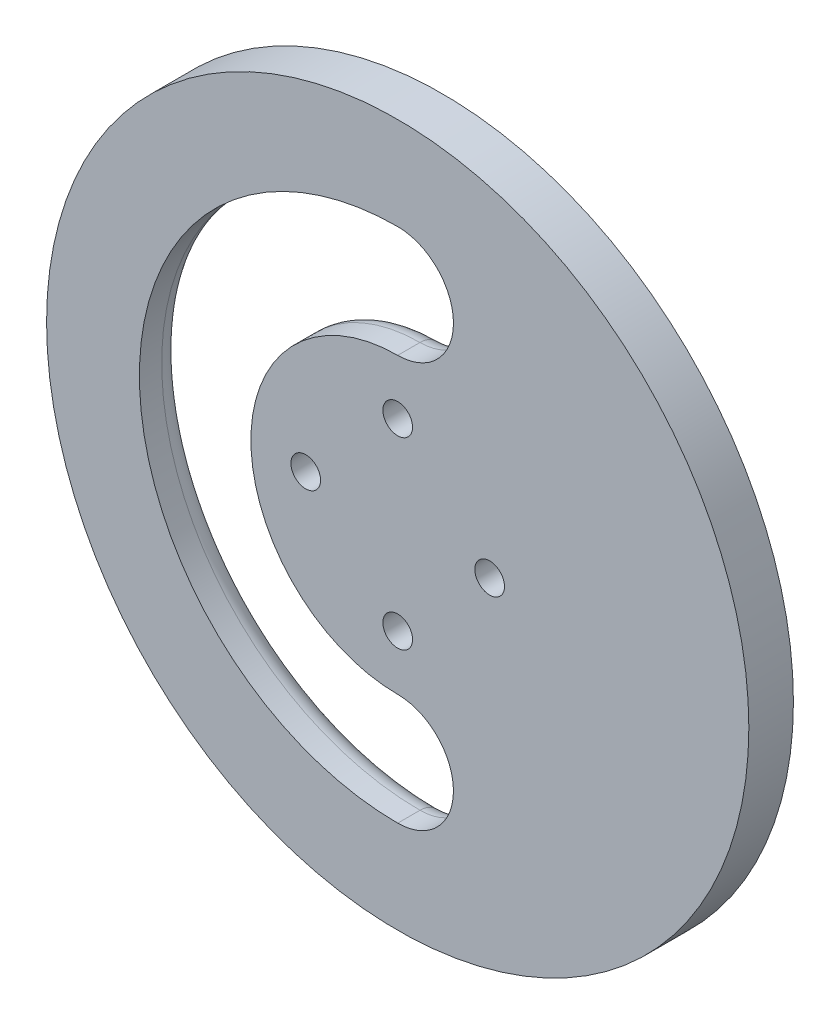
from build123d import *

# Parameters (mm, degrees)
SKETCH1_R              = 31.5
ELBOW_PLATE_DEPTH      = 4
SKETCH2_R              = 1.33
HORN_SCREW_HOLES_DEPTH = 4
SKETCH3_R              = 1.33
SCREW_HOLES_DEPTH      = 3
CABLE_SLOT_DEPTH       = 4
FILLET1_R              = 2


with BuildPart() as part:
    # Sketch1 → Elbow Plate (new body)
    with BuildSketch(Plane.XY):
        Circle(SKETCH1_R)
    extrude(amount=ELBOW_PLATE_DEPTH)

    # Sketch2 → Horn Screw Holes (cut)
    with BuildSketch(Plane(origin=(0, 0, 0), x_dir=(-1, 0, 0), z_dir=(0, 0, -1))):
        with Locations((0, 8.25)):
            Circle(SKETCH2_R)
        with Locations((8.25, 0)):
            Circle(SKETCH2_R)
        with Locations((0, -8.25)):
            Circle(SKETCH2_R)
        with Locations((-8.25, 0)):
            Circle(SKETCH2_R)
    extrude(amount=-HORN_SCREW_HOLES_DEPTH, mode=Mode.SUBTRACT)

    # Sketch3 → Screw Holes (cut)
    with BuildSketch(Plane(origin=(0, 0, 0), x_dir=(-1, 0, 0), z_dir=(0, 0, -1))):
        with Locations((22.9496732, 13.25)):
            Circle(SKETCH3_R)
        with Locations((0, 26.5)):
            Circle(SKETCH3_R)
        with Locations((22.9496732, -13.25)):
            Circle(SKETCH3_R)
        with Locations((0, -26.5)):
            Circle(SKETCH3_R)
        with Locations((-22.9496732, -13.25)):
            Circle(SKETCH3_R)
        with Locations((-22.9496732, 13.25)):
            Circle(SKETCH3_R)
    extrude(amount=-SCREW_HOLES_DEPTH, mode=Mode.SUBTRACT)

    # Sketch4 → Cable Slot (cut)
    with BuildSketch(Plane.XY.offset(4)):
        with BuildLine():
            ThreePointArc((0, -23.172318516), (5.001159258, -18.171159258), (0, -13.17))
            ThreePointArc((0, -13.17), (-13.17, 0), (0, 13.17))
            ThreePointArc((0, 13.17), (5.001159258, 18.171159258), (0, 23.172318516))
            ThreePointArc((0, 23.172318516), (-23.172318516, 0), (0, -23.172318516))
        make_face()
    extrude(amount=-CABLE_SLOT_DEPTH, mode=Mode.SUBTRACT)

    # Fillet1
    fillet1_edges = [part.edges().sort_by_distance(p)[0] for p in [
        (-23.172318516, 0, 0),
        (5.001159258, 18.171159258, 0),
        (-13.17, 0, 0),
        (5.001159258, -18.171159258, 0),
    ]]
    fillet(fillet1_edges, radius=FILLET1_R)


solid = part.part
